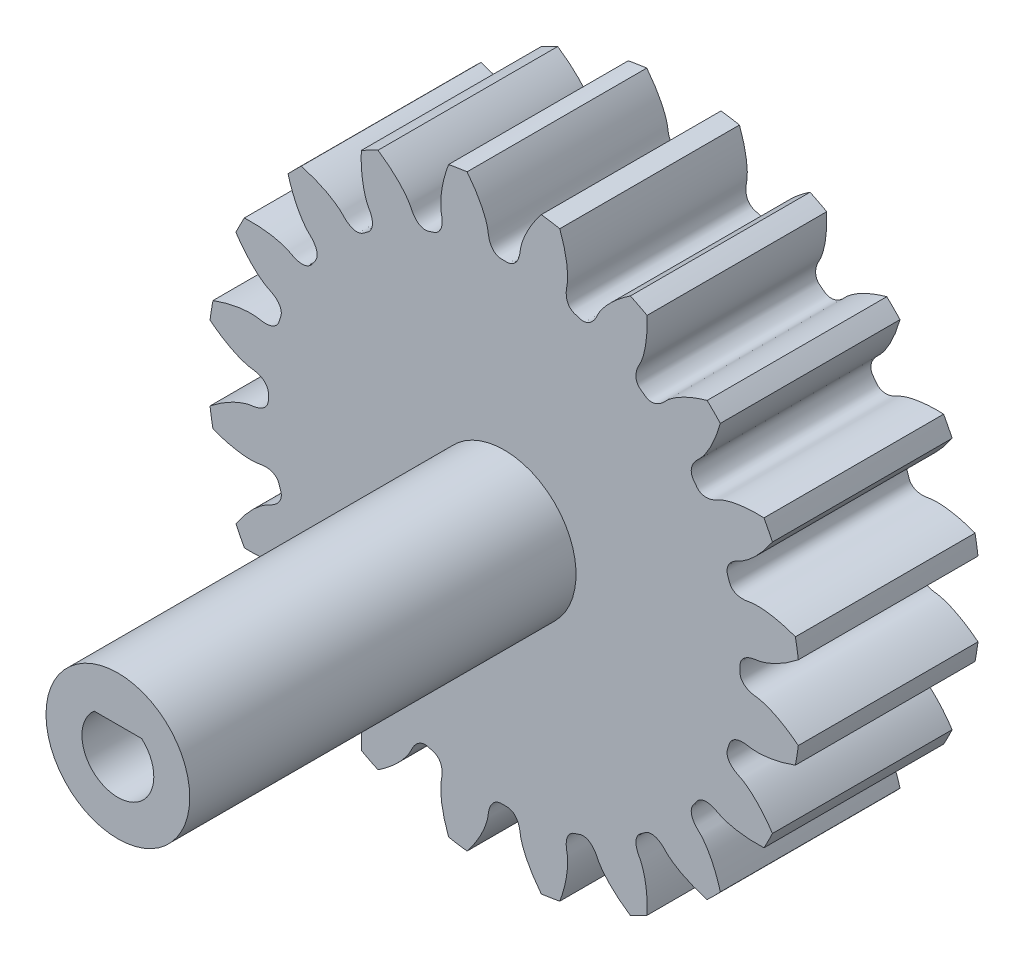
from build123d import *

# Parameters (mm, degrees)
SKETCHREVOLVESPURASSEMBLY01PINION_W       = 10
SKETCHREVOLVESPURASSEMBLY01PINION_H       = 16.499999752
TOOTHEXTRUDECUTSPURASSEMBLY01PINION_DEPTH = 5
PATTERNSPURASSEMBLY01PINION_COUNT         = 20
SKETCH1_R                                 = 4
BOSS_EXTRUDE1_DEPTH                       = 21.5
CUT_EXTRUDE5_DEPTH                        = 8
BOSS_EXTRUDE5_START                       = 5
SKETCH8_R                                 = 4
BOSS_EXTRUDE5_DEPTH                       = 5


with BuildPart() as part:
    # SketchRevolveSpurAssembly01Pinion → SpurAssembly01Pinion (revolve)
    with BuildSketch(Plane(origin=(0, 0, 0), x_dir=(0, 0, -1), z_dir=(1, 0, 0))):
        with Locations((0, 8.249999876)):
            Rectangle(SKETCHREVOLVESPURASSEMBLY01PINION_W, SKETCHREVOLVESPURASSEMBLY01PINION_H)
    revolve(axis=Axis((0, 0, 0), (0, 0, -1)))

    # SketchToothSpurAssembly01Pinion → ToothExtrudeCutSpurAssembly01Pinion (cut, symmetric)
    with BuildSketch(Plane.XY):
        with BuildLine():
            ThreePointArc((16.438815928, 2.120364973), (16.574999751, 0), (16.438815928, -2.120364973))
            add(Edge.make_bspline(
                [(16.438815928, -2.120364973), (16.306213447, -2.012632117), (16.10792267, -1.860929635), (15.841705586, -1.676668952), (15.654853966, -1.55570694), (15.475899367, -1.447553762), (15.305444286, -1.351598726), (15.144060802, -1.267206194), (14.992289617, -1.193717223), (14.850639167, -1.130450865), (14.719584807, -1.0767054), (14.599567969, -1.031760257), (14.490995634, -0.99487577), (14.394239041, -0.965299916), (14.309634999, -0.942253529), (14.237479548, -0.924980687), (14.178044201, -0.912608864), (14.049223501, -0.890261122), (13.912281496, -0.878231728), (13.769652297, -0.842658369), (13.695599357, -0.820644128), (13.624377747, -0.794966749), (13.555692175, -0.765356143), (13.489258635, -0.731124882), (13.424830796, -0.691333031), (13.362331646, -0.644635632), (13.30209452, -0.589245233), (13.24524803, -0.523019137), (13.194309632, -0.443877425), (13.153279262, -0.350864326), (13.130262908, -0.253354669), (13.120821868, -0.134969136), (13.12767395, 0), (13.120821868, 0.134969136), (13.130262908, 0.253354669), (13.153279262, 0.350864326), (13.194309632, 0.443877425), (13.24524803, 0.523019137), (13.30209452, 0.589245233), (13.362331646, 0.644635632), (13.424830796, 0.691333031), (13.489258635, 0.731124882), (13.555692175, 0.765356143), (13.624377747, 0.794966749), (13.695599357, 0.820644128), (13.769652297, 0.842658369), (13.912281496, 0.878231728), (14.049223501, 0.890261122), (14.178044201, 0.912608864), (14.237479548, 0.924980687), (14.309634999, 0.942253529), (14.394239041, 0.965299916), (14.490995634, 0.99487577), (14.599567969, 1.031760257), (14.719584807, 1.0767054), (14.850639167, 1.130450865), (14.992289617, 1.193717223), (15.144060802, 1.267206194), (15.305444286, 1.351598726), (15.475899367, 1.447553762), (15.654853966, 1.55570694), (15.841705586, 1.676668952), (16.10792267, 1.860929635), (16.306213447, 2.012632117), (16.438815928, 2.120364973)],
                knots=[0, 0, 0, 0, 0.061422842, 0.089709677, 0.116380121, 0.141434175, 0.164871838, 0.186693111, 0.206897994, 0.225486485, 0.242458587, 0.257814298, 0.271553618, 0.283676548, 0.294183087, 0.303073236, 0.310346995, 0.316004363, 0.350076802, 0.359567688, 0.36880314, 0.37784437, 0.386769007, 0.395675631, 0.404688756, 0.413962948, 0.423682731, 0.434051196, 0.445255861, 0.457401439, 0.47041984, 0.481066796, 0.5, 0.518933204, 0.52958016, 0.542598561, 0.554744139, 0.565948804, 0.576317269, 0.586037052, 0.595311244, 0.604324369, 0.613230993, 0.62215563, 0.63119686, 0.640432312, 0.649923198, 0.683995637, 0.689653005, 0.696926764, 0.705816913, 0.716323452, 0.728446382, 0.742185702, 0.757541413, 0.774513515, 0.793102006, 0.813306889, 0.835128162, 0.858565825, 0.883619879, 0.910290323, 0.938577158, 1, 1, 1, 1], degree=3))
        make_face()
    toothextrudecutspurassembly01pinion = extrude(amount=TOOTHEXTRUDECUTSPURASSEMBLY01PINION_DEPTH, both=True, mode=Mode.SUBTRACT)

    # PatternSpurAssembly01Pinion: ToothExtrudeCutSpurAssembly01Pinion ×20 about axis
    patternspurassembly01pinion_axis = Axis((0, 0, 55), (0, 0, -1))
    for i in range(1, PATTERNSPURASSEMBLY01PINION_COUNT):
        add(toothextrudecutspurassembly01pinion.rotate(patternspurassembly01pinion_axis, i * 360 / PATTERNSPURASSEMBLY01PINION_COUNT), mode=Mode.SUBTRACT)

    # Sketch1 → Boss-Extrude1 (add)
    with BuildSketch(Plane.XY.offset(5)):
        Circle(SKETCH1_R)
    extrude(amount=BOSS_EXTRUDE1_DEPTH)

    # Sketch7 → Cut-Extrude5 (cut)
    with BuildSketch(Plane.XY.offset(26.5)):
        with BuildLine():
            Line((1.322875656, 1.5), (-1.322875656, 1.5))
            ThreePointArc((-1.322875656, 1.5), (0, -2), (1.322875656, 1.5))
        make_face()
    extrude(amount=-CUT_EXTRUDE5_DEPTH, mode=Mode.SUBTRACT)

    # Sketch8 → Boss-Extrude5 (add)
    with BuildSketch(Plane(origin=(0, 0, -5), x_dir=(-1, 0, 0), z_dir=(0, 0, -1)).offset(BOSS_EXTRUDE5_START)):
        Circle(SKETCH8_R)
    extrude(amount=-BOSS_EXTRUDE5_DEPTH)


solid = part.part
